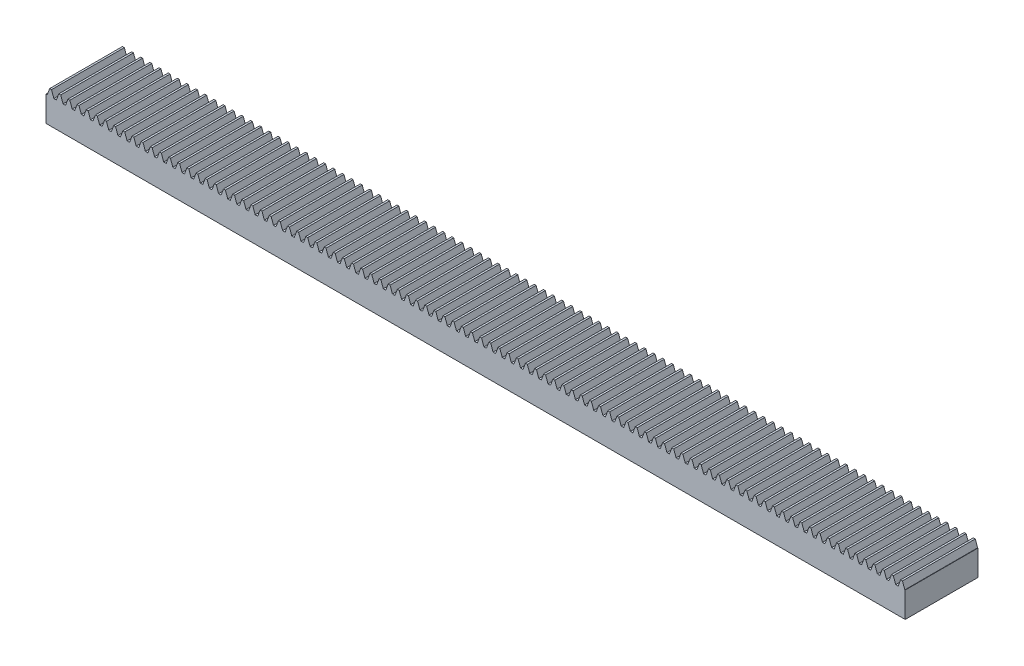
from build123d import *

# Parameters (mm, degrees)
BLANKSKE_W        = 590
BLANKSKE_H        = 22
BLANK_DEPTH       = 50
TOOTHCUTSIM_DEPTH = 593.523417259
TEETHCUTS_COUNT   = 95
TEETHCUTS_PITCH   = 6.2831853


with BuildPart() as part:
    # BlankSke → Blank (new body)
    with BuildSketch(Plane.XY):
        with Locations((295, 11)):
            Rectangle(BLANKSKE_W, BLANKSKE_H)
    extrude(amount=-BLANK_DEPTH)

    # TooCutSkeSim → ToothCutSim (cut, through all)
    with BuildSketch(Plane.XY):
        Polygon((0.861870739, 17.5), (-0.861870739, 17.5), (-2.508981637, 22.0254), (2.508981637, 22.0254), align=None)
    toothcutsim = extrude(amount=-TOOTHCUTSIM_DEPTH, mode=Mode.SUBTRACT)

    # TeethCuts: ToothCutSim ×95
    with Locations(*[(i * TEETHCUTS_PITCH, 0, 0) for i in range(1, TEETHCUTS_COUNT)]):
        add(toothcutsim, mode=Mode.SUBTRACT)


solid = part.part
